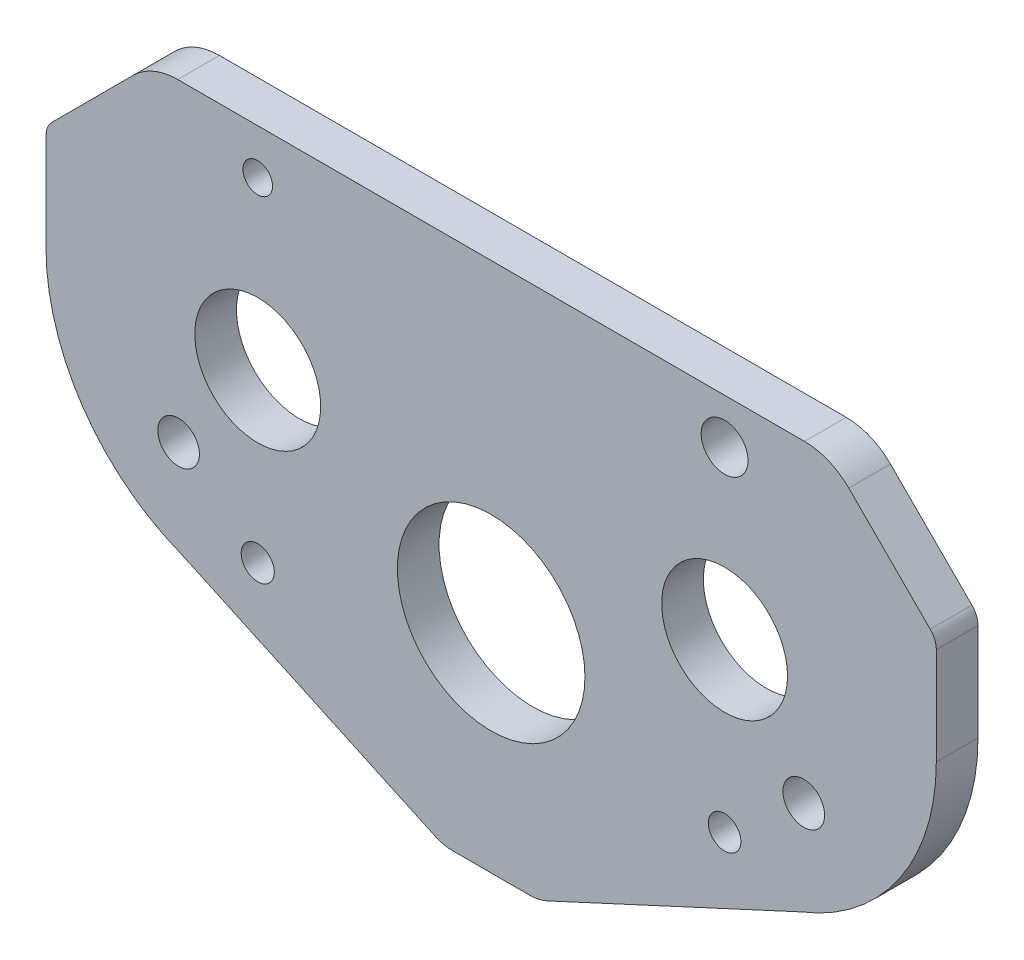
from build123d import *

# Parameters (mm, degrees)
SKETCH1_R           = 14.2875
SKETCH1_R_2         = 9.5885
SKETCH1_R_3         = 3.175
SKETCH1_R_4         = 2.257278931
SKETCH1_R_5         = 2.521989484
SKETCH1_R_6         = 2.481468777
SKETCH1_R_7         = 3.567111366
BOSS_EXTRUDE1_DEPTH = 3.175
FILLET1_R           = 9.525
FILLET2_R           = 3.175
FILLET3_R           = 6.35


with BuildPart() as part:
    # Sketch1 → Boss-Extrude1 (new, symmetric)
    with BuildSketch(Plane.XY):
        with BuildLine():
            Line((-35.563882813, 47.798897166), (35.563882813, 47.798897166))
            Line((35.563882813, 47.798897166), (51.692882813, 47.798897166))
            Line((51.692882813, 47.798897166), (67.821882813, 31.669897166))
            Line((67.821882813, 31.669897166), (67.821882813, 15.540897166))
            ThreePointArc((67.821882813, 15.540897166), (62.208310766, -2.642969943), (47.321354383, -14.498084612))
            Line((47.321354383, -14.498084612), (7.26457678, -33.02))
            Line((7.26457678, -33.02), (-7.26457678, -33.02))
            Line((-7.26457678, -33.02), (-47.321354383, -14.498084612))
            ThreePointArc((-47.321354383, -14.498084612), (-62.208310766, -2.642969943), (-67.821882813, 15.540897166))
            Line((-67.821882813, 15.540897166), (-67.821882813, 31.669897166))
            Line((-67.821882813, 31.669897166), (-51.692882813, 47.798897166))
            Line((-51.692882813, 47.798897166), (-35.563882813, 47.798897166))
        make_face()
        Circle(SKETCH1_R, mode=Mode.SUBTRACT)
        with Locations((35.563882813, 15.540897166)):
            Circle(SKETCH1_R_2, mode=Mode.SUBTRACT)
        with Locations((-35.563882813, 15.540897166)):
            Circle(SKETCH1_R_2, mode=Mode.SUBTRACT)
        with Locations((-47.625, 0)):
            Circle(SKETCH1_R_3, mode=Mode.SUBTRACT)
        with Locations((47.625, 0)):
            Circle(SKETCH1_R_3, mode=Mode.SUBTRACT)
        with Locations((-35.563882813, 40.940897166)):
            Circle(SKETCH1_R_4, mode=Mode.SUBTRACT)
        with Locations((-35.563882813, -9.859102834)):
            Circle(SKETCH1_R_5, mode=Mode.SUBTRACT)
        with Locations((35.563882813, -9.859102834)):
            Circle(SKETCH1_R_6, mode=Mode.SUBTRACT)
        with Locations((35.563882813, 40.940897166)):
            Circle(SKETCH1_R_7, mode=Mode.SUBTRACT)
    extrude(amount=BOSS_EXTRUDE1_DEPTH, both=True)

    # Fillet1
    fillet1_edges = [part.edges().sort_by_distance(p)[0] for p in [
        (51.692882813, 47.798897166, 0),
        (-51.692882813, 47.798897166, 0),
    ]]
    fillet(fillet1_edges, radius=FILLET1_R)

    # Fillet2
    fillet2_edges = [part.edges().sort_by_distance(p)[0] for p in [
        (67.821882813, 31.669897166, 0),
        (-67.821882813, 31.669897166, 0),
    ]]
    fillet(fillet2_edges, radius=FILLET2_R)

    # Fillet3
    fillet3_edges = [part.edges().sort_by_distance(p)[0] for p in [
        (7.26457678, -33.02, 0),
        (-7.26457678, -33.02, 0),
    ]]
    fillet(fillet3_edges, radius=FILLET3_R)


solid = part.part
